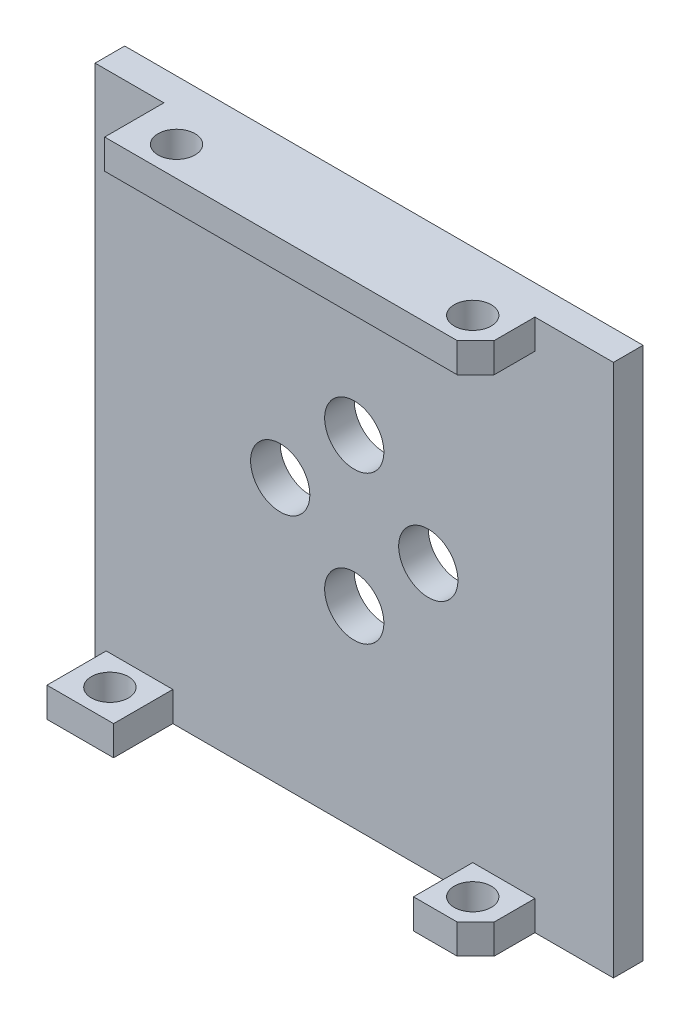
from build123d import *

# Parameters (mm, degrees)
CROQUIS1_W              = 36
CROQUIS1_H              = 35
CROQUIS1_R              = 2
SALIENTE_EXTRUIR1_DEPTH = 2
CROQUIS2_R              = 1.25
SALIENTE_EXTRUIR2_DEPTH = 2
SALIENTE_EXTRUIR3_START = -2
CROQUIS3_W              = 4.5
CROQUIS3_H              = 6
CROQUIS3_R              = 1.25140183
CROQUIS3_R_2            = 1.25
SALIENTE_EXTRUIR3_DEPTH = 2


with BuildPart() as part:
    # Croquis1 → Saliente-Extruir1 (new body)
    with BuildSketch(Plane(origin=(0, 0, 0), x_dir=(0, 1, 0), z_dir=(0, 0, 1))):
        Rectangle(CROQUIS1_W, CROQUIS1_H)
        with Locations(Location((0, 5, 0), (0, 0, 270))):
            Circle(CROQUIS1_R, mode=Mode.SUBTRACT)
        with Locations(Location((5, 0, 0), (0, 0, 270))):
            Circle(CROQUIS1_R, mode=Mode.SUBTRACT)
        with Locations(Location((0, -5, 0), (0, 0, 270))):
            Circle(CROQUIS1_R, mode=Mode.SUBTRACT)
        with Locations(Location((-5, 0, 0), (0, 0, 270))):
            Circle(CROQUIS1_R, mode=Mode.SUBTRACT)
    extrude(amount=SALIENTE_EXTRUIR1_DEPTH)

    # Croquis2 → Saliente-Extruir2 (add)
    with BuildSketch(Plane(origin=(0, 18, 0), x_dir=(-1, 0, 0), z_dir=(0, 1, 0))):
        Polygon((-10.95, 6), (12.85345456, 6), (12.85345456, 0), (-12.2, 0), (-12.2, 4.75), align=None)
        with Locations((-10, 4)):
            Circle(CROQUIS2_R, mode=Mode.SUBTRACT)
        with Locations(Location((10, 4, 0), (0, 0, 180))):
            Circle(CROQUIS2_R, mode=Mode.SUBTRACT)
    extrude(amount=-SALIENTE_EXTRUIR2_DEPTH)

    # Croquis3 → Saliente-Extruir3 (add)
    # profile 1 of 2: a face of its own
    with BuildSketch(Plane.XZ.offset(18).offset(SALIENTE_EXTRUIR3_START)):
        with Locations((-14.5, 3)):
            Rectangle(CROQUIS3_W, CROQUIS3_H)
        with Locations((-14.5, 4)):
            Circle(CROQUIS3_R, mode=Mode.SUBTRACT)
    # profile 2 of 2: a face of its own
    with BuildSketch(Plane.XZ.offset(18).offset(SALIENTE_EXTRUIR3_START)):
        Polygon((12.2, 4.75), (10.95, 6), (8, 6), (8, 2), (12.2, 2), align=None)
        with Locations(Location((10, 4, 0), (0, 0, 180))):
            Circle(CROQUIS3_R_2, mode=Mode.SUBTRACT)
    extrude(amount=SALIENTE_EXTRUIR3_DEPTH)


solid = part.part
